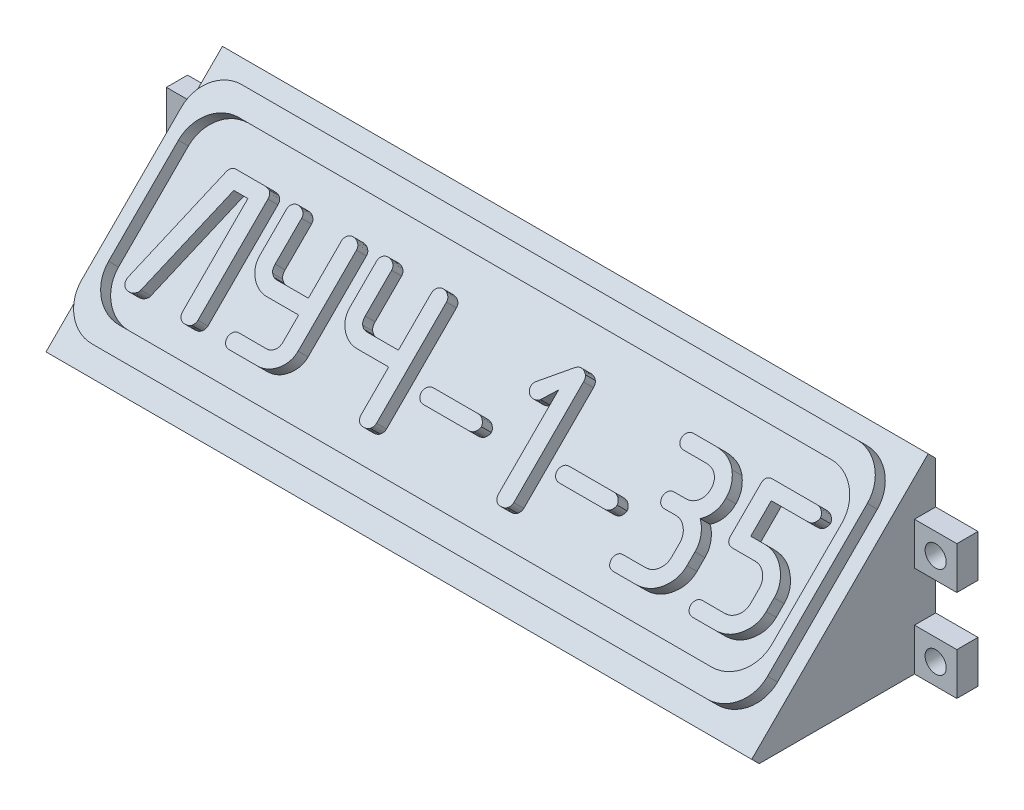
from build123d import *

# Parameters (mm, degrees)
EXTRUDE_1_DEPTH     = 50
CUT_EXTRUDE_1_DEPTH = 213.132034356
SKETCH_3_W          = 200
SKETCH_3_H          = 70.710678119
EXTRUDE_2_DEPTH     = 3
EXTRUDE_3_DEPTH     = 4
SKETCH_5_W          = 194.429654202
SKETCH_5_H          = 60
SKETCH_5_W_2        = 188
SKETCH_5_H_2        = 48
EXTRUDE_4_DEPTH     = 4
FILLET_1_R          = 10
SKETCH_6_W          = 12
SKETCH_6_H          = 12
SKETCH_6_R          = 3
EXTRUDE_5_DEPTH     = 6


with BuildPart() as part:
    # Эскиз1 → Бобышка-Вытянуть1 (new body)
    with BuildSketch(Plane(origin=(0, 0, 0), x_dir=(1, 0, 0), z_dir=(0, 1, 0))):
        Polygon((0, 0), (100, 0), (100, 50), (92, 50), (92, 8), (-92, 8), (-92, 50), (-100, 50), (-100, 0), align=None)
    extrude(amount=EXTRUDE_1_DEPTH)

    # Эскиз2 → Вырез-Вытянуть1 (cut, through all)
    with BuildSketch(Plane(origin=(100, 0, 0), x_dir=(0, 0, -1), z_dir=(1, 0, 0))):
        Polygon((0, 0), (0, 50), (50, 50), align=None)
    extrude(amount=-CUT_EXTRUDE_1_DEPTH, mode=Mode.SUBTRACT)

    # Эскиз3 → Бобышка-Вытянуть2 (add)
    with BuildSketch(Plane(origin=(0, 0, 0), x_dir=(1, 0, 0), z_dir=(0, 0.7071067811865474, 0.7071067811865477))):
        with Locations((0, 35.35533906)):
            Rectangle(SKETCH_3_W, SKETCH_3_H)
    extrude(amount=EXTRUDE_2_DEPTH)

    # Эскиз4 → Бобышка-Вытянуть3 (add)
    with BuildSketch(Plane(origin=(0, 2.121320344, 2.121320344), x_dir=(1, 0, 0), z_dir=(0, 0.7071067811865476, 0.7071067811865476))):
        with BuildLine():
            add(Edge.make_bspline(
                [(-68.75610477, 20.726091118), (-68.762630295, 20.596290065), (-68.775818947, 20.33395089), (-68.928925444, 19.954515658), (-69.143325973, 19.573958429), (-69.349908958, 19.350593076), (-69.458807473, 19.232847875)],
                knots=[0, 0, 0, 0, 0.915549064, 1.850403998, 2.866858221, 4, 4, 4, 4], degree=3))
            add(Edge.make_bspline(
                [(-69.458807473, 19.232847875), (-69.557018144, 19.155530235), (-69.764551665, 18.992146747), (-70.160156441, 18.844570702), (-70.623846008, 18.758511321), (-70.9560755, 18.746210297), (-71.134483148, 18.739604631)],
                knots=[0, 0, 0, 0, 0.836344935, 1.767319243, 2.801047675, 4, 4, 4, 4], degree=3))
            add(Edge.make_bspline(
                [(-71.134483148, 18.739604631), (-71.261288839, 18.746140205), (-71.509552353, 18.758935724), (-71.868243024, 18.859088148), (-72.205140544, 19.014263307), (-72.507750278, 19.239019575), (-72.773843335, 19.519875908), (-72.944245157, 19.880138063), (-73.068879563, 20.285380276), (-73.076447204, 20.578576094), (-73.080429094, 20.732847875)],
                knots=[0, 0, 0, 0, 0.970455498, 1.899983282, 2.834306599, 3.797520365, 4.775163954, 5.763265543, 6.823090279, 8, 8, 8, 8], degree=3))
            Line((-73.080429094, 20.732847875), (-73.080429094, 46.847712739))
            Line((-73.080429094, 46.847712739), (-77.066915581, 46.847712739))
            Line((-77.066915581, 46.847712739), (-84.593942608, 20.239604631))
            add(Edge.make_bspline(
                [(-84.593942608, 20.239604631), (-84.612488388, 20.15926614), (-84.652268426, 19.986942937), (-84.80705154, 19.73926588), (-85.035894883, 19.489588889), (-85.330239798, 19.242745342), (-85.67649211, 19.019065125), (-86.06474102, 18.856009391), (-86.485648626, 18.759151704), (-86.775858601, 18.74624074), (-86.925023689, 18.739604631)],
                knots=[0, 0, 0, 0, 0.663693597, 1.423599114, 2.327562058, 3.401457102, 4.524383031, 5.652035845, 6.793169396, 8, 8, 8, 8], degree=3))
            add(Edge.make_bspline(
                [(-86.925023689, 18.739604631), (-87.065252053, 18.746130508), (-87.33780213, 18.758814304), (-87.728727912, 18.856369384), (-88.084885015, 19.011587961), (-88.39890298, 19.229443915), (-88.663117122, 19.505113542), (-88.83655749, 19.852269931), (-88.959427453, 20.240313898), (-88.967915303, 20.520070521), (-88.972320986, 20.665280307)],
                knots=[0, 0, 0, 0, 1.061366862, 2.062889505, 3.033106798, 3.989267705, 4.943142053, 5.889662298, 6.904613293, 8, 8, 8, 8], degree=3))
            add(Edge.make_bspline(
                [(-88.972320986, 20.665280307), (-88.965344484, 20.787561054), (-88.953498157, 20.995197726), (-88.904588912, 21.197132997), (-88.884483148, 21.280145172)],
                knots=[0, 0, 0, 0, 1.177833825, 2, 2, 2, 2], degree=3))
            Line((-88.884483148, 21.280145172), (-81.00610477, 49.266631658))
            add(Edge.make_bspline(
                [(-81.00610477, 49.266631658), (-80.969711164, 49.383234768), (-80.899591004, 49.607895899), (-80.730604806, 49.906196308), (-80.543676296, 50.168240036), (-80.318642148, 50.382890542), (-80.053128645, 50.539547241), (-79.758770818, 50.653820253), (-79.431358864, 50.73300615), (-79.200296379, 50.737350784), (-79.080429094, 50.739604631)],
                knots=[0, 0, 0, 0, 1.110346038, 2.139322002, 3.108387218, 4.037936335, 4.949860985, 5.899151764, 6.910152063, 8, 8, 8, 8], degree=3))
            Line((-79.080429094, 50.739604631), (-71.195293959, 50.739604631))
            add(Edge.make_bspline(
                [(-71.195293959, 50.739604631), (-71.003584158, 50.732659583), (-70.644927717, 50.71966658), (-70.141368975, 50.637145543), (-69.715373637, 50.480750704), (-69.357056608, 50.265571161), (-69.088507592, 49.971060906), (-68.892021152, 49.620625821), (-68.777803821, 49.2059437), (-68.763586177, 48.909243507), (-68.75610477, 48.753118145)],
                knots=[0, 0, 0, 0, 1.280704927, 2.395981154, 3.390630075, 4.296225214, 5.1583056, 6.020254761, 6.958246576, 8, 8, 8, 8], degree=3))
            Line((-68.75610477, 48.753118145), (-68.75610477, 20.726091118))
        make_face()
        with BuildLine():
            Line((-47.999348013, 31.712577604), (-56.904753418, 31.712577604))
            add(Edge.make_bspline(
                [(-56.904753418, 31.712577604), (-57.128020967, 31.71716694), (-57.569588319, 31.726243496), (-58.219187145, 31.816599654), (-58.844423986, 31.964029352), (-59.442668127, 32.177041309), (-60.018618768, 32.442373645), (-60.578566135, 32.757507812), (-61.102978917, 33.150059101), (-61.609138846, 33.581373686), (-62.06122261, 34.065781942), (-62.467844713, 34.574772593), (-62.803203237, 35.116583835), (-63.08449806, 35.681160618), (-63.300737217, 36.272775804), (-63.458541915, 36.890282577), (-63.544548354, 37.536744349), (-63.559377691, 37.975858345), (-63.566915581, 38.199064091)],
                knots=[0, 0, 0, 0, 1.035673756, 2.048303581, 3.0370765, 4.012331002, 4.989879499, 5.977823305, 6.987643866, 8.025056878, 9.060255784, 10.057720171, 11.043837474, 12.011500143, 12.980460439, 13.961579086, 14.963851612, 16, 16, 16, 16], degree=3))
            Line((-63.566915581, 38.199064091), (-63.566915581, 48.793658685))
            add(Edge.make_bspline(
                [(-63.566915581, 48.793658685), (-63.561002076, 48.920607655), (-63.549164785, 49.174726288), (-63.433412508, 49.546102231), (-63.25076385, 49.901431055), (-63.079981225, 50.111725883), (-62.992591256, 50.219334361)],
                knots=[0, 0, 0, 0, 0.967126161, 1.935933617, 2.943811199, 4, 4, 4, 4], degree=3))
            add(Edge.make_bspline(
                [(-62.992591256, 50.219334361), (-62.891862375, 50.30033561), (-62.693468138, 50.459874569), (-62.35079697, 50.61956449), (-61.991483667, 50.719575543), (-61.745507988, 50.732872391), (-61.620969635, 50.739604631)],
                knots=[0, 0, 0, 0, 1.031857106, 2.03233173, 3.003762623, 4, 4, 4, 4], degree=3))
            add(Edge.make_bspline(
                [(-61.620969635, 50.739604631), (-61.460419505, 50.733979565), (-61.14668209, 50.722987397), (-60.698244195, 50.612400636), (-60.28980143, 50.432618431), (-59.927352751, 50.191720454), (-59.622094564, 49.899074021), (-59.401018911, 49.561888476), (-59.261830571, 49.189205665), (-59.249114413, 48.927770259), (-59.242591256, 48.793658685)],
                knots=[0, 0, 0, 0, 1.126357484, 2.201060098, 3.221373681, 4.248414814, 5.244384402, 6.170518649, 7.061509588, 8, 8, 8, 8], degree=3))
            Line((-59.242591256, 48.793658685), (-59.242591256, 38.199064091))
            add(Edge.make_bspline(
                [(-59.242591256, 38.199064091), (-59.235592841, 38.004562946), (-59.222430654, 37.638757223), (-59.105139733, 37.129619129), (-58.923321089, 36.688697345), (-58.728450364, 36.458644751), (-58.634483148, 36.347712739)],
                knots=[0, 0, 0, 0, 1.167822052, 2.196367477, 3.130283289, 4, 4, 4, 4], degree=3))
            add(Edge.make_bspline(
                [(-58.634483148, 36.347712739), (-58.551047979, 36.280282015), (-58.400319004, 36.158465713), (-58.196984879, 35.991221221), (-58.030548612, 35.871935056), (-57.931925852, 35.80695296), (-57.891239905, 35.780145172)],
                knots=[0, 0, 0, 0, 1.375792092, 2.485423497, 3.375174871, 4, 4, 4, 4], degree=3))
            add(Edge.make_bspline(
                [(-57.891239905, 35.780145172), (-57.728031409, 35.730823285), (-57.427674245, 35.640054835), (-57.115064439, 35.615624735), (-56.972320986, 35.604469496)],
                knots=[0, 0, 0, 0, 1.086762796, 2, 2, 2, 2], degree=3))
            Line((-56.972320986, 35.604469496), (-47.999348013, 35.604469496))
            Line((-47.999348013, 35.604469496), (-47.999348013, 48.793658685))
            add(Edge.make_bspline(
                [(-47.999348013, 48.793658685), (-47.993434508, 48.920607655), (-47.981597218, 49.174726288), (-47.865844941, 49.546102231), (-47.683196282, 49.901431055), (-47.512413657, 50.111725883), (-47.425023689, 50.219334361)],
                knots=[0, 0, 0, 0, 0.967126161, 1.935933617, 2.943811199, 4, 4, 4, 4], degree=3))
            add(Edge.make_bspline(
                [(-47.425023689, 50.219334361), (-47.324294807, 50.30033561), (-47.125900571, 50.459874569), (-46.783229403, 50.61956449), (-46.4239161, 50.719575543), (-46.17794042, 50.732872391), (-46.053402067, 50.739604631)],
                knots=[0, 0, 0, 0, 1.031857106, 2.03233173, 3.003762623, 4, 4, 4, 4], degree=3))
            add(Edge.make_bspline(
                [(-46.053402067, 50.739604631), (-45.892916617, 50.733822304), (-45.579305597, 50.722522829), (-45.129063842, 50.613904827), (-44.721949471, 50.425100147), (-44.359322919, 50.178096136), (-44.054104286, 49.878514209), (-43.833247076, 49.534563395), (-43.694285846, 49.155231227), (-43.681554673, 48.889457712), (-43.675023689, 48.753118145)],
                knots=[0, 0, 0, 0, 1.116529258, 2.181854371, 3.199692143, 4.226556143, 5.224865236, 6.156092035, 7.054090793, 8, 8, 8, 8], degree=3))
            Line((-43.675023689, 48.753118145), (-43.675023689, 25.401766794))
            add(Edge.make_bspline(
                [(-43.675023689, 25.401766794), (-43.681998948, 25.187474136), (-43.695870013, 24.761329795), (-43.792036388, 24.133912565), (-43.949706965, 23.52554643), (-44.166045546, 22.933268677), (-44.451767445, 22.359432622), (-44.798507557, 21.80341551), (-45.205889983, 21.265452522), (-45.676189086, 20.761137), (-46.184526135, 20.284724916), (-46.740750259, 19.8755177), (-47.321951552, 19.52005004), (-47.938819158, 19.233859978), (-48.588120149, 19.009294906), (-49.273099629, 18.857633842), (-49.987502627, 18.759237607), (-50.474239133, 18.746232916), (-50.722320986, 18.739604631)],
                knots=[0, 0, 0, 0, 0.954782777, 1.898689774, 2.821279558, 3.75164312, 4.70320268, 5.672383268, 6.66801769, 7.70503157, 8.74204545, 9.767778877, 10.776429994, 11.773227215, 12.792063222, 13.83169644, 14.894850172, 16, 16, 16, 16], degree=3))
            Line((-50.722320986, 18.739604631), (-58.452050716, 18.739604631))
            add(Edge.make_bspline(
                [(-58.452050716, 18.739604631), (-58.594860649, 18.744753265), (-58.871452802, 18.754725061), (-59.264181826, 18.870893838), (-59.623486641, 19.041570045), (-59.820295646, 19.214387247), (-59.918266932, 19.300415442)],
                knots=[0, 0, 0, 0, 1.061408071, 2.055719351, 3.032139439, 4, 4, 4, 4], degree=3))
            add(Edge.make_bspline(
                [(-59.918266932, 19.300415442), (-59.996409369, 19.399215832), (-60.150955975, 19.594618811), (-60.316169508, 19.933855499), (-60.411046738, 20.302025552), (-60.424811005, 20.556632252), (-60.431780446, 20.685550577)],
                knots=[0, 0, 0, 0, 0.999299836, 1.9763704, 2.97534928, 4, 4, 4, 4], degree=3))
            add(Edge.make_bspline(
                [(-60.431780446, 20.685550577), (-60.425527554, 20.801252062), (-60.413021772, 21.032655033), (-60.302397247, 21.369929641), (-60.138379576, 21.699202215), (-59.911282284, 22.012650541), (-59.627370029, 22.29113156), (-59.277314455, 22.493549739), (-58.875837067, 22.608782557), (-58.592442373, 22.623733481), (-58.445293959, 22.631496523)],
                knots=[0, 0, 0, 0, 0.896873142, 1.793746284, 2.732993467, 3.748250934, 4.788101686, 5.799732142, 6.857544153, 8, 8, 8, 8], degree=3))
            Line((-58.445293959, 22.631496523), (-50.675023689, 22.631496523))
            add(Edge.make_bspline(
                [(-50.675023689, 22.631496523), (-50.496132759, 22.63997201), (-50.143106807, 22.65669766), (-49.636103349, 22.807858382), (-49.179282437, 23.069907612), (-48.768978058, 23.412328594), (-48.419214208, 23.836476003), (-48.176845852, 24.342423202), (-48.020928061, 24.908319779), (-48.006738021, 25.308317498), (-47.999348013, 25.516631658)],
                knots=[0, 0, 0, 0, 0.974167649, 1.922436556, 2.851822555, 3.828465071, 4.824079232, 5.823852042, 6.866687452, 8, 8, 8, 8], degree=3))
            Line((-47.999348013, 25.516631658), (-47.999348013, 31.712577604))
        make_face()
        with BuildLine():
            Line((-22.4858345, 35.604469496), (-22.4858345, 48.793658685))
            add(Edge.make_bspline(
                [(-22.4858345, 48.793658685), (-22.479920995, 48.920607655), (-22.468083704, 49.174726288), (-22.352331427, 49.546102231), (-22.169682769, 49.901431055), (-21.998900144, 50.111725883), (-21.911510175, 50.219334361)],
                knots=[0, 0, 0, 0, 0.967126161, 1.935933617, 2.943811199, 4, 4, 4, 4], degree=3))
            add(Edge.make_bspline(
                [(-21.911510175, 50.219334361), (-21.810781293, 50.30033561), (-21.612387057, 50.459874569), (-21.269715889, 50.61956449), (-20.910402586, 50.719575543), (-20.664426907, 50.732872391), (-20.539888554, 50.739604631)],
                knots=[0, 0, 0, 0, 1.031857106, 2.03233173, 3.003762623, 4, 4, 4, 4], degree=3))
            add(Edge.make_bspline(
                [(-20.539888554, 50.739604631), (-20.379403104, 50.733822304), (-20.065792084, 50.722522829), (-19.615550329, 50.613904827), (-19.208435957, 50.425100147), (-18.845809405, 50.178096136), (-18.540590772, 49.878514209), (-18.319733562, 49.534563395), (-18.180772332, 49.155231227), (-18.168041159, 48.889457712), (-18.161510175, 48.753118145)],
                knots=[0, 0, 0, 0, 1.116529258, 2.181854371, 3.199692143, 4.226556143, 5.224865236, 6.156092035, 7.054090793, 8, 8, 8, 8], degree=3))
            Line((-18.161510175, 48.753118145), (-18.161510175, 20.726091118))
            add(Edge.make_bspline(
                [(-18.161510175, 20.726091118), (-18.1680357, 20.596290065), (-18.181224352, 20.33395089), (-18.334330849, 19.954515658), (-18.548731378, 19.573958429), (-18.755314364, 19.350593076), (-18.864212878, 19.232847875)],
                knots=[0, 0, 0, 0, 0.915549064, 1.850403998, 2.866858221, 4, 4, 4, 4], degree=3))
            add(Edge.make_bspline(
                [(-18.864212878, 19.232847875), (-18.962423549, 19.155530235), (-19.16995707, 18.992146747), (-19.565561847, 18.844570702), (-20.029251414, 18.758511321), (-20.361480906, 18.746210297), (-20.539888554, 18.739604631)],
                knots=[0, 0, 0, 0, 0.836344935, 1.767319243, 2.801047675, 4, 4, 4, 4], degree=3))
            add(Edge.make_bspline(
                [(-20.539888554, 18.739604631), (-20.666633271, 18.746281181), (-20.914777411, 18.759352706), (-21.275282802, 18.857757017), (-21.610858051, 19.021889518), (-21.913371213, 19.252831549), (-22.181581327, 19.541795985), (-22.349259769, 19.914633916), (-22.474311774, 20.332867829), (-22.481864346, 20.634893264), (-22.4858345, 20.793658685)],
                knots=[0, 0, 0, 0, 0.955036435, 1.869795435, 2.796619091, 3.754672073, 4.729445222, 5.732233119, 6.807905155, 8, 8, 8, 8], degree=3))
            Line((-22.4858345, 20.793658685), (-22.4858345, 31.712577604))
            Line((-22.4858345, 31.712577604), (-31.391239905, 31.712577604))
            add(Edge.make_bspline(
                [(-31.391239905, 31.712577604), (-31.614507453, 31.71716694), (-32.056074806, 31.726243496), (-32.705673632, 31.816599654), (-33.330910472, 31.964029352), (-33.929154613, 32.177041309), (-34.505105254, 32.442373645), (-35.065052622, 32.757507812), (-35.589465404, 33.150059101), (-36.095625333, 33.581373686), (-36.547709096, 34.065781942), (-36.954331199, 34.574772593), (-37.289689723, 35.116583835), (-37.570984547, 35.681160618), (-37.787223703, 36.272775804), (-37.945028402, 36.890282577), (-38.031034841, 37.536744349), (-38.045864177, 37.975858345), (-38.053402067, 38.199064091)],
                knots=[0, 0, 0, 0, 1.035673756, 2.048303581, 3.0370765, 4.012331002, 4.989879499, 5.977823305, 6.987643866, 8.025056878, 9.060255784, 10.057720171, 11.043837474, 12.011500143, 12.980460439, 13.961579086, 14.963851612, 16, 16, 16, 16], degree=3))
            Line((-38.053402067, 38.199064091), (-38.053402067, 48.793658685))
            add(Edge.make_bspline(
                [(-38.053402067, 48.793658685), (-38.047488562, 48.920607655), (-38.035651272, 49.174726288), (-37.919898995, 49.546102231), (-37.737250336, 49.901431055), (-37.566467711, 50.111725883), (-37.479077743, 50.219334361)],
                knots=[0, 0, 0, 0, 0.967126161, 1.935933617, 2.943811199, 4, 4, 4, 4], degree=3))
            add(Edge.make_bspline(
                [(-37.479077743, 50.219334361), (-37.378348861, 50.30033561), (-37.179954625, 50.459874569), (-36.837283457, 50.61956449), (-36.477970154, 50.719575543), (-36.231994474, 50.732872391), (-36.107456121, 50.739604631)],
                knots=[0, 0, 0, 0, 1.031857106, 2.03233173, 3.003762623, 4, 4, 4, 4], degree=3))
            add(Edge.make_bspline(
                [(-36.107456121, 50.739604631), (-35.946905991, 50.733979565), (-35.633168577, 50.722987397), (-35.184730682, 50.612400636), (-34.776287917, 50.432618431), (-34.413839237, 50.191720454), (-34.10858105, 49.899074021), (-33.887505397, 49.561888476), (-33.748317057, 49.189205665), (-33.735600899, 48.927770259), (-33.729077743, 48.793658685)],
                knots=[0, 0, 0, 0, 1.126357484, 2.201060098, 3.221373681, 4.248414814, 5.244384402, 6.170518649, 7.061509588, 8, 8, 8, 8], degree=3))
            Line((-33.729077743, 48.793658685), (-33.729077743, 38.199064091))
            add(Edge.make_bspline(
                [(-33.729077743, 38.199064091), (-33.722079327, 38.004562946), (-33.708917141, 37.638757223), (-33.591626219, 37.129619129), (-33.409807576, 36.688697345), (-33.21493685, 36.458644751), (-33.120969635, 36.347712739)],
                knots=[0, 0, 0, 0, 1.167822052, 2.196367477, 3.130283289, 4, 4, 4, 4], degree=3))
            add(Edge.make_bspline(
                [(-33.120969635, 36.347712739), (-33.037534465, 36.280282015), (-32.886805491, 36.158465713), (-32.683471366, 35.991221221), (-32.517035098, 35.871935056), (-32.418412338, 35.80695296), (-32.377726391, 35.780145172)],
                knots=[0, 0, 0, 0, 1.375792092, 2.485423497, 3.375174871, 4, 4, 4, 4], degree=3))
            add(Edge.make_bspline(
                [(-32.377726391, 35.780145172), (-32.214517896, 35.730823285), (-31.914160732, 35.640054835), (-31.601550925, 35.615624735), (-31.458807473, 35.604469496)],
                knots=[0, 0, 0, 0, 1.086762796, 2, 2, 2, 2], degree=3))
            Line((-31.458807473, 35.604469496), (-22.4858345, 35.604469496))
        make_face()
        with BuildLine():
            Line((2.102003338, 28.685550577), (-10.431780446, 28.685550577))
            add(Edge.make_bspline(
                [(-10.431780446, 28.685550577), (-10.574501978, 28.690990166), (-10.853098572, 28.7016084), (-11.249035589, 28.81514212), (-11.61077921, 28.989390869), (-11.811109213, 29.160570131), (-11.911510175, 29.246361388)],
                knots=[0, 0, 0, 0, 1.05367648, 2.056807225, 3.026114798, 4, 4, 4, 4], degree=3))
            add(Edge.make_bspline(
                [(-11.911510175, 29.246361388), (-11.992360506, 29.344827158), (-12.151425718, 29.538549042), (-12.315883104, 29.880015953), (-12.411121168, 30.247915752), (-12.424836024, 30.50255946), (-12.431780446, 30.631496523)],
                knots=[0, 0, 0, 0, 1.007300164, 1.981765708, 2.978081156, 4, 4, 4, 4], degree=3))
            add(Edge.make_bspline(
                [(-12.431780446, 30.631496523), (-12.42555638, 30.74722), (-12.41310825, 30.978666953), (-12.302044524, 31.315606494), (-12.13923087, 31.647448003), (-11.903625833, 31.956139637), (-11.62019655, 32.239745724), (-11.264872371, 32.437619008), (-10.862552117, 32.555097275), (-10.579006976, 32.569805464), (-10.431780446, 32.577442469)],
                knots=[0, 0, 0, 0, 0.894019722, 1.788039445, 2.724298395, 3.746649061, 4.783191508, 5.806732337, 6.861178898, 8, 8, 8, 8], degree=3))
            Line((-10.431780446, 32.577442469), (2.102003338, 32.577442469))
            add(Edge.make_bspline(
                [(2.102003338, 32.577442469), (2.280833184, 32.57112737), (2.623381656, 32.559030801), (3.105973194, 32.426518625), (3.529661499, 32.213602119), (3.883736135, 31.924481452), (4.155895593, 31.595516852), (4.377764265, 31.279109761), (4.507991589, 30.954080517), (4.525863682, 30.736064655), (4.534435771, 30.631496523)],
                knots=[0, 0, 0, 0, 1.252626121, 2.399404643, 3.481239833, 4.560298709, 5.580657481, 6.470831737, 7.266556721, 8, 8, 8, 8], degree=3))
            add(Edge.make_bspline(
                [(4.534435771, 30.631496523), (4.527095624, 30.536181645), (4.511523752, 30.333974378), (4.401327683, 30.02439217), (4.220805679, 29.702446528), (3.985057394, 29.366175499), (3.662837181, 29.05209282), (3.221851075, 28.837536457), (2.693604249, 28.700432141), (2.307968359, 28.690731573), (2.102003338, 28.685550577)],
                knots=[0, 0, 0, 0, 0.660560635, 1.401356889, 2.253898629, 3.2161103, 4.243656392, 5.333295804, 6.575734779, 8, 8, 8, 8], degree=3))
        make_face()
        with BuildLine():
            add(Edge.make_bspline(
                [(20.757408744, 20.726091118), (20.750514218, 20.596434266), (20.736466617, 20.332258325), (20.588125059, 19.950567235), (20.367612021, 19.573200883), (20.163170669, 19.350826644), (20.054706041, 19.232847875)],
                knots=[0, 0, 0, 0, 0.915262352, 1.864847777, 2.867213074, 4, 4, 4, 4], degree=3))
            add(Edge.make_bspline(
                [(20.054706041, 19.232847875), (19.95649537, 19.155530235), (19.748961849, 18.992146747), (19.353357072, 18.844570702), (18.889667505, 18.758511321), (18.557438013, 18.746210297), (18.379030365, 18.739604631)],
                knots=[0, 0, 0, 0, 0.836344935, 1.767319243, 2.801047675, 4, 4, 4, 4], degree=3))
            add(Edge.make_bspline(
                [(18.379030365, 18.739604631), (18.252224678, 18.746140207), (18.003961171, 18.758935728), (17.645270451, 18.859088132), (17.308373117, 19.014263368), (17.00576266, 19.239019338), (16.73967237, 19.519876812), (16.569259832, 19.880134547), (16.444004851, 20.28755852), (16.436866344, 20.583053635), (16.433084419, 20.739604631)],
                knots=[0, 0, 0, 0, 0.968371671, 1.895903512, 2.828220588, 3.789366078, 4.764910405, 5.750890277, 6.808439288, 8, 8, 8, 8], degree=3))
            Line((16.433084419, 20.739604631), (16.433084419, 44.746361388))
            Line((16.433084419, 44.746361388), (13.791192527, 41.266631658))
            add(Edge.make_bspline(
                [(13.791192527, 41.266631658), (13.684250543, 41.176085004), (13.466232761, 40.991491639), (13.063568087, 40.801873676), (12.600708674, 40.695818655), (12.273760058, 40.680227568), (12.102003338, 40.672037064)],
                knots=[0, 0, 0, 0, 0.913450038, 1.862209237, 2.87694913, 4, 4, 4, 4], degree=3))
            add(Edge.make_bspline(
                [(12.102003338, 40.672037064), (11.981761095, 40.678135318), (11.736472108, 40.690575494), (11.379490705, 40.807689836), (11.02310554, 40.977666078), (10.808805871, 41.140717114), (10.696597933, 41.226091118)],
                knots=[0, 0, 0, 0, 0.934684398, 1.906715833, 2.903950235, 4, 4, 4, 4], degree=3))
            add(Edge.make_bspline(
                [(10.696597933, 41.226091118), (10.596570728, 41.327808008), (10.403440393, 41.524200749), (10.209153757, 41.880388276), (10.076155666, 42.25273917), (10.061913123, 42.513206874), (10.054706041, 42.645010037)],
                knots=[0, 0, 0, 0, 1.064137443, 2.054613257, 3.01558573, 4, 4, 4, 4], degree=3))
            add(Edge.make_bspline(
                [(10.054706041, 42.645010037), (10.061161002, 42.758391355), (10.074076034, 42.985243762), (10.182449434, 43.319127099), (10.360438716, 43.637543832), (10.51989922, 43.829802407), (10.602003338, 43.928793821)],
                knots=[0, 0, 0, 0, 0.951424687, 1.903602679, 2.920592565, 4, 4, 4, 4], degree=3))
            Line((10.602003338, 43.928793821), (16.926327663, 50.050415442))
            add(Edge.make_bspline(
                [(16.926327663, 50.050415442), (17.047780049, 50.159277769), (17.28563738, 50.372478211), (17.681964932, 50.638873938), (18.130073296, 50.821338482), (18.451589486, 50.838806529), (18.615516852, 50.847712739)],
                knots=[0, 0, 0, 0, 1.019784961, 1.997188649, 2.97885208, 4, 4, 4, 4], degree=3))
            add(Edge.make_bspline(
                [(18.615516852, 50.847712739), (18.753988609, 50.837958712), (19.040087417, 50.817805753), (19.466137, 50.665764343), (19.890100854, 50.415478392), (20.152472731, 50.194354082), (20.291192527, 50.077442469)],
                knots=[0, 0, 0, 0, 0.880341502, 1.81888826, 2.846814756, 4, 4, 4, 4], degree=3))
            add(Edge.make_bspline(
                [(20.291192527, 50.077442469), (20.362606598, 49.976067216), (20.506247025, 49.772163636), (20.652808773, 49.423053717), (20.745085162, 49.043961419), (20.753216819, 48.780715239), (20.757408744, 48.645010037)],
                knots=[0, 0, 0, 0, 0.967253322, 1.945508478, 2.9408956, 4, 4, 4, 4], degree=3))
            Line((20.757408744, 48.645010037), (20.757408744, 20.726091118))
        make_face()
        with BuildLine():
            Line((40.588489825, 28.685550577), (28.054706041, 28.685550577))
            add(Edge.make_bspline(
                [(28.054706041, 28.685550577), (27.911984509, 28.690990166), (27.633387914, 28.7016084), (27.237450898, 28.81514212), (26.875707276, 28.989390869), (26.675377274, 29.160570131), (26.574976311, 29.246361388)],
                knots=[0, 0, 0, 0, 1.05367648, 2.056807225, 3.026114798, 4, 4, 4, 4], degree=3))
            add(Edge.make_bspline(
                [(26.574976311, 29.246361388), (26.49412598, 29.344827158), (26.335060769, 29.538549042), (26.170603383, 29.880015953), (26.075365319, 30.247915752), (26.061650463, 30.50255946), (26.054706041, 30.631496523)],
                knots=[0, 0, 0, 0, 1.007300164, 1.981765708, 2.978081156, 4, 4, 4, 4], degree=3))
            add(Edge.make_bspline(
                [(26.054706041, 30.631496523), (26.060930106, 30.74722), (26.073378237, 30.978666953), (26.184441962, 31.315606494), (26.347255616, 31.647448003), (26.582860653, 31.956139637), (26.866289936, 32.239745724), (27.221614115, 32.437619008), (27.62393437, 32.555097275), (27.90747951, 32.569805464), (28.054706041, 32.577442469)],
                knots=[0, 0, 0, 0, 0.894019722, 1.788039445, 2.724298395, 3.746649061, 4.783191508, 5.806732337, 6.861178898, 8, 8, 8, 8], degree=3))
            Line((28.054706041, 32.577442469), (40.588489825, 32.577442469))
            add(Edge.make_bspline(
                [(40.588489825, 32.577442469), (40.767319671, 32.57112737), (41.109868142, 32.559030801), (41.59245968, 32.426518625), (42.016147986, 32.213602119), (42.370222621, 31.924481452), (42.64238208, 31.595516852), (42.864250752, 31.279109761), (42.994478076, 30.954080517), (43.012350168, 30.736064655), (43.020922257, 30.631496523)],
                knots=[0, 0, 0, 0, 1.252626121, 2.399404643, 3.481239833, 4.560298709, 5.580657481, 6.470831737, 7.266556721, 8, 8, 8, 8], degree=3))
            add(Edge.make_bspline(
                [(43.020922257, 30.631496523), (43.01358211, 30.536181645), (42.998010239, 30.333974378), (42.887814169, 30.02439217), (42.707292165, 29.702446528), (42.47154388, 29.366175499), (42.149323667, 29.05209282), (41.708337561, 28.837536457), (41.180090735, 28.700432141), (40.794454846, 28.690731573), (40.588489825, 28.685550577)],
                knots=[0, 0, 0, 0, 0.660560635, 1.401356889, 2.253898629, 3.2161103, 4.243656392, 5.333295804, 6.575734779, 8, 8, 8, 8], degree=3))
        make_face()
        with BuildLine():
            Line((56.791192527, 46.847712739), (50.45335469, 46.847712739))
            add(Edge.make_bspline(
                [(50.45335469, 46.847712739), (50.308443794, 46.853256782), (50.025538555, 46.864080252), (49.624229864, 46.975620924), (49.259992045, 47.153412749), (49.056183896, 47.3229735), (48.95335469, 47.40852355)],
                knots=[0, 0, 0, 0, 1.058158881, 2.065812162, 3.024126364, 4, 4, 4, 4], degree=3))
            add(Edge.make_bspline(
                [(48.95335469, 47.40852355), (48.872504359, 47.50698932), (48.713439147, 47.700711204), (48.548981761, 48.042178115), (48.453743697, 48.410077915), (48.440028841, 48.664721622), (48.433084419, 48.793658685)],
                knots=[0, 0, 0, 0, 1.007300164, 1.981765708, 2.978081156, 4, 4, 4, 4], degree=3))
            add(Edge.make_bspline(
                [(48.433084419, 48.793658685), (48.439337311, 48.90936017), (48.451843093, 49.140763141), (48.562467618, 49.478037749), (48.726485289, 49.807310323), (48.953582581, 50.120758649), (49.237494836, 50.399239668), (49.58755041, 50.601657847), (49.989027798, 50.716890665), (50.272422492, 50.73184159), (50.419570906, 50.739604631)],
                knots=[0, 0, 0, 0, 0.896873142, 1.793746284, 2.732993467, 3.748250934, 4.788101686, 5.799732142, 6.857544153, 8, 8, 8, 8], degree=3))
            Line((50.419570906, 50.739604631), (56.649300636, 50.739604631))
            add(Edge.make_bspline(
                [(56.649300636, 50.739604631), (56.985242847, 50.731838997), (57.638896572, 50.716729149), (58.590604989, 50.598949803), (59.487535527, 50.412753027), (60.329538225, 50.144317238), (61.109466319, 49.787233589), (61.839370304, 49.370222695), (62.510114895, 48.866748468), (62.903814407, 48.472070103), (63.102003338, 48.273388415)],
                knots=[0, 0, 0, 0, 1.13341989, 2.205332069, 3.230945865, 4.221254155, 5.180537684, 6.120475399, 7.053844463, 8, 8, 8, 8], degree=3))
            add(Edge.make_bspline(
                [(63.102003338, 48.273388415), (63.277210245, 48.071621353), (63.623359311, 47.672998484), (64.065170594, 47.028589708), (64.447914509, 46.370532193), (64.763642149, 45.691503098), (64.997022104, 44.987477215), (65.168411938, 44.264270598), (65.271729915, 43.521882799), (65.284683828, 43.019203232), (65.291192527, 42.766631658)],
                knots=[0, 0, 0, 0, 1.056133692, 2.086559815, 3.084278045, 4.064788451, 5.042259387, 6.012396743, 7.001327852, 8, 8, 8, 8], degree=3))
            add(Edge.make_bspline(
                [(65.291192527, 42.766631658), (65.286441985, 42.462201693), (65.277036614, 41.859475472), (65.14934623, 40.970794918), (64.908911831, 40.118581153), (64.570960854, 39.3063018), (64.137425937, 38.543363776), (63.618463535, 37.831915164), (63.009783269, 37.177973912), (62.541626988, 36.801665522), (62.304706041, 36.611226253)],
                knots=[0, 0, 0, 0, 1.026966331, 2.033241159, 3.020031122, 4.008284081, 4.99551317, 5.974719338, 6.975061468, 8, 8, 8, 8], degree=3))
            add(Edge.make_bspline(
                [(62.304706041, 36.611226253), (62.507964381, 36.447735799), (62.924076179, 36.113037076), (63.470794565, 35.48805134), (63.982716411, 34.773399377), (64.44385546, 33.968403962), (64.834051225, 33.104687146), (65.114994537, 32.19789725), (65.275221272, 31.263464035), (65.285840836, 30.632101738), (65.291192527, 30.313928956)],
                knots=[0, 0, 0, 0, 0.866803985, 1.774526765, 2.752324719, 3.790045522, 4.857216549, 5.90058151, 6.942005526, 8, 8, 8, 8], degree=3))
            Line((65.291192527, 30.313928956), (65.297949284, 27.131496523))
            add(Edge.make_bspline(
                [(65.297949284, 27.131496523), (65.289618414, 26.86086047), (65.273089893, 26.323916098), (65.157319432, 25.530625783), (64.958198466, 24.762128631), (64.688113436, 24.017031056), (64.340407436, 23.294453733), (63.911584292, 22.595761085), (63.402821746, 21.921351851), (62.827344973, 21.276034673), (62.19000792, 20.687569797), (61.513989223, 20.163819946), (60.798212963, 19.717909611), (60.039615578, 19.361671379), (59.245057539, 19.081967306), (58.413351579, 18.888428292), (57.545104043, 18.761257118), (56.951563477, 18.746910634), (56.649300636, 18.739604631)],
                knots=[0, 0, 0, 0, 0.970801741, 1.926079414, 2.868698377, 3.814428873, 4.764876258, 5.74044097, 6.750431083, 7.791832276, 8.838143038, 9.857911005, 10.855707632, 11.856868197, 12.858582888, 13.871799816, 14.916205779, 16, 16, 16, 16], degree=3))
            Line((56.649300636, 18.739604631), (50.419570906, 18.739604631))
            add(Edge.make_bspline(
                [(50.419570906, 18.739604631), (50.276865747, 18.745066166), (49.998301115, 18.755727242), (49.602135743, 18.86895488), (49.236745473, 19.046495071), (49.031223864, 19.219084339), (48.926327663, 19.307172199)],
                knots=[0, 0, 0, 0, 1.04413253, 2.038177155, 2.998704971, 4, 4, 4, 4], degree=3))
            add(Edge.make_bspline(
                [(48.926327663, 19.307172199), (48.850502941, 19.4106941), (48.701284718, 19.614418609), (48.545072454, 19.955837342), (48.454984281, 20.316090433), (48.440456745, 20.561176253), (48.433084419, 20.685550577)],
                knots=[0, 0, 0, 0, 1.030422284, 2.027805432, 2.999165404, 4, 4, 4, 4], degree=3))
            add(Edge.make_bspline(
                [(48.433084419, 20.685550577), (48.440113225, 20.798805902), (48.454270346, 21.02691993), (48.554473086, 21.363062309), (48.713619823, 21.689929148), (48.925262561, 22.007828678), (49.207571834, 22.286890078), (49.560826802, 22.496167226), (49.980449539, 22.609302989), (50.277024798, 22.623844628), (50.433084419, 22.631496523)],
                knots=[0, 0, 0, 0, 0.872420718, 1.757192482, 2.681291623, 3.668475677, 4.687512535, 5.714798453, 6.797513696, 8, 8, 8, 8], degree=3))
            Line((50.433084419, 22.631496523), (56.70335469, 22.631496523))
            add(Edge.make_bspline(
                [(56.70335469, 22.631496523), (56.986617879, 22.646685162), (57.546012878, 22.676680053), (58.349952354, 22.927943789), (59.083695199, 23.348657255), (59.736771978, 23.910862889), (60.283156859, 24.590798121), (60.689148041, 25.352323249), (60.927294499, 26.189625119), (60.957909702, 26.767365746), (60.97362496, 27.063928956)],
                knots=[0, 0, 0, 0, 0.993475619, 1.961939683, 2.925576866, 3.94673414, 4.971012636, 5.972520021, 6.959263134, 8, 8, 8, 8], degree=3))
            Line((60.97362496, 27.063928956), (60.97362496, 30.307172199))
            add(Edge.make_bspline(
                [(60.97362496, 30.307172199), (60.961537607, 30.601843928), (60.937869183, 31.178844956), (60.685418503, 32.005508637), (60.298111553, 32.770388428), (59.754552643, 33.443408371), (59.115973265, 34.021076141), (58.377759767, 34.44350794), (57.561811848, 34.695642168), (56.993411695, 34.724750517), (56.70335469, 34.739604631)],
                knots=[0, 0, 0, 0, 1.030923828, 2.018667042, 3.004670295, 4.022795447, 5.036002388, 6.009257811, 6.984115828, 8, 8, 8, 8], degree=3))
            Line((56.70335469, 34.739604631), (53.561462798, 34.739604631))
            add(Edge.make_bspline(
                [(53.561462798, 34.739604631), (53.418708936, 34.744967073), (53.140049234, 34.755434717), (52.742610486, 34.870610209), (52.373038877, 35.044368759), (52.166226943, 35.218807335), (52.061462798, 35.307172199)],
                knots=[0, 0, 0, 0, 1.040282098, 2.030660999, 3.002397432, 4, 4, 4, 4], degree=3))
            add(Edge.make_bspline(
                [(52.061462798, 35.307172199), (51.985749131, 35.410775557), (51.837957049, 35.613007951), (51.679355393, 35.953588403), (51.582306686, 36.313075381), (51.568427951, 36.561084978), (51.561462798, 36.685550577)],
                knots=[0, 0, 0, 0, 1.028974178, 2.008544084, 3.000571928, 4, 4, 4, 4], degree=3))
            add(Edge.make_bspline(
                [(51.561462798, 36.685550577), (51.56846735, 36.798820797), (51.58257562, 37.026964828), (51.683154229, 37.362876359), (51.841329056, 37.691839647), (52.06112013, 38.008168742), (52.348864105, 38.284954789), (52.704276875, 38.497983146), (53.129407743, 38.608887216), (53.430258316, 38.623703789), (53.588489825, 38.631496523)],
                knots=[0, 0, 0, 0, 0.866315224, 1.744895057, 2.662527041, 3.652607709, 4.676920528, 5.697017153, 6.788752676, 8, 8, 8, 8], degree=3))
            Line((53.588489825, 38.631496523), (56.770922257, 38.631496523))
            add(Edge.make_bspline(
                [(56.770922257, 38.631496523), (57.078906796, 38.646232706), (57.678164056, 38.674905459), (58.531168925, 38.922293629), (59.292311928, 39.344256128), (59.708616947, 39.736691877), (59.919570906, 39.935550577)],
                knots=[0, 0, 0, 0, 1.052500521, 2.047890389, 3.010808826, 4, 4, 4, 4], degree=3))
            add(Edge.make_bspline(
                [(59.919570906, 39.935550577), (60.081588815, 40.136991546), (60.405141127, 40.539272326), (60.7327711, 41.249190954), (60.93676191, 42.020987451), (60.961108383, 42.558079151), (60.97362496, 42.834199226)],
                knots=[0, 0, 0, 0, 0.980805097, 1.958683196, 2.950554346, 4, 4, 4, 4], degree=3))
            add(Edge.make_bspline(
                [(60.97362496, 42.834199226), (60.963528348, 43.101343869), (60.943912898, 43.620345904), (60.746150878, 44.358784545), (60.439337601, 45.035129684), (60.12907698, 45.40992597), (59.97362496, 45.597712739)],
                knots=[0, 0, 0, 0, 1.063590795, 2.066318012, 3.03115397, 4, 4, 4, 4], degree=3))
            add(Edge.make_bspline(
                [(59.97362496, 45.597712739), (59.772406112, 45.791080958), (59.368295241, 46.179425291), (58.599004168, 46.570346942), (57.728386197, 46.803709003), (57.112611902, 46.832621244), (56.791192527, 46.847712739)],
                knots=[0, 0, 0, 0, 0.947415208, 1.902708361, 2.905264196, 4, 4, 4, 4], degree=3))
        make_face()
        with BuildLine():
            Line((75.24389523, 46.847712739), (75.24389523, 38.631496523))
            Line((75.24389523, 38.631496523), (79.081733068, 38.631496523))
            add(Edge.make_bspline(
                [(79.081733068, 38.631496523), (79.383879729, 38.623377015), (79.976887027, 38.607441286), (80.846481572, 38.491890536), (81.679172688, 38.293976515), (82.474362623, 38.018859483), (83.234165196, 37.661562147), (83.958578207, 37.230197256), (84.64204772, 36.712784249), (85.279787354, 36.126818316), (85.862244087, 35.490820157), (86.377074425, 34.822711598), (86.815079262, 34.129797437), (87.166856944, 33.408089705), (87.447491436, 32.662487424), (87.643147473, 31.887469088), (87.759743274, 31.08775507), (87.776160988, 30.546293456), (87.784435771, 30.273388415)],
                knots=[0, 0, 0, 0, 1.081972753, 2.123530799, 3.135044873, 4.142692043, 5.131436003, 6.137144145, 7.156730983, 8.195818544, 9.234906105, 10.24164886, 11.212964997, 12.165340004, 13.112268028, 14.061118053, 15.022773467, 16, 16, 16, 16], degree=3))
            Line((87.784435771, 30.273388415), (87.784435771, 27.097712739))
            add(Edge.make_bspline(
                [(87.784435771, 27.097712739), (87.77617407, 26.827077645), (87.759850821, 26.292364049), (87.644093514, 25.503407873), (87.443019057, 24.740148929), (87.176124808, 23.994973224), (86.820214207, 23.277301113), (86.391751658, 22.581776442), (85.880380682, 21.913935609), (85.307032565, 21.269486963), (84.67189629, 20.680221377), (83.991547947, 20.164333575), (83.279555888, 19.719456141), (82.524555185, 19.360200612), (81.729471554, 19.081017292), (80.895136475, 18.889304762), (80.027097181, 18.761444531), (79.435801822, 18.746955935), (79.135787122, 18.739604631)],
                knots=[0, 0, 0, 0, 0.973115338, 1.922655314, 2.85967792, 3.807662264, 4.763914069, 5.734903704, 6.740833204, 7.784716246, 8.833520556, 9.850797801, 10.850972359, 11.847204032, 12.851305993, 13.874818936, 14.921713909, 16, 16, 16, 16], degree=3))
            Line((79.135787122, 18.739604631), (72.906057392, 18.739604631))
            add(Edge.make_bspline(
                [(72.906057392, 18.739604631), (72.763266818, 18.744778104), (72.486712159, 18.754798007), (72.09371711, 18.870625453), (71.733782902, 19.04332534), (71.533474538, 19.214584262), (71.433084419, 19.300415442)],
                knots=[0, 0, 0, 0, 1.057924657, 2.048972727, 3.022188321, 4, 4, 4, 4], degree=3))
            add(Edge.make_bspline(
                [(71.433084419, 19.300415442), (71.354941983, 19.399215832), (71.200395376, 19.594618811), (71.035181844, 19.933855499), (70.940304614, 20.302025552), (70.926540346, 20.556632252), (70.919570906, 20.685550577)],
                knots=[0, 0, 0, 0, 0.999299836, 1.9763704, 2.97534928, 4, 4, 4, 4], degree=3))
            add(Edge.make_bspline(
                [(70.919570906, 20.685550577), (70.925794971, 20.801274054), (70.938243102, 21.032721007), (71.049306827, 21.369660548), (71.212120481, 21.701502057), (71.447725518, 22.010193691), (71.731154801, 22.293799778), (72.08647898, 22.491673062), (72.488799235, 22.609151329), (72.772344375, 22.623859518), (72.919570906, 22.631496523)],
                knots=[0, 0, 0, 0, 0.894019722, 1.788039445, 2.724298395, 3.746649061, 4.783191508, 5.806732337, 6.861178898, 8, 8, 8, 8], degree=3))
            Line((72.919570906, 22.631496523), (79.189841176, 22.631496523))
            add(Edge.make_bspline(
                [(79.189841176, 22.631496523), (79.473246638, 22.646475241), (80.02794602, 22.675792551), (80.825124792, 22.926661609), (81.562677104, 23.324033654), (82.214188442, 23.879677171), (82.775650746, 24.540657612), (83.168904393, 25.31433225), (83.416600653, 26.163733644), (83.445329753, 26.758110321), (83.460111446, 27.063928956)],
                knots=[0, 0, 0, 0, 0.991348919, 1.940331813, 2.901160524, 3.909927732, 4.924762166, 5.920470752, 6.930040799, 8, 8, 8, 8], degree=3))
            Line((83.460111446, 27.063928956), (83.460111446, 30.307172199))
            add(Edge.make_bspline(
                [(83.460111446, 30.307172199), (83.448202858, 30.604105472), (83.424970963, 31.183378399), (83.172063244, 32.012445513), (82.784000849, 32.776469729), (82.243211697, 33.452936729), (81.593722419, 34.018596962), (80.859794387, 34.442557284), (80.046228172, 34.69641118), (79.479927663, 34.724973587), (79.189841176, 34.739604631)],
                knots=[0, 0, 0, 0, 1.038660488, 2.026273092, 3.012145964, 4.030136488, 5.043948606, 6.017075334, 6.98425016, 8, 8, 8, 8], degree=3))
            Line((79.189841176, 34.739604631), (72.919570906, 34.739604631))
            add(Edge.make_bspline(
                [(72.919570906, 34.739604631), (72.763863699, 34.746698499), (72.469979596, 34.76008757), (72.054782856, 34.842833055), (71.705298368, 35.002377593), (71.407117181, 35.212470009), (71.189894202, 35.501135261), (71.030151733, 35.843447615), (70.938285778, 36.246209799), (70.926018665, 36.534186286), (70.919570906, 36.685550577)],
                knots=[0, 0, 0, 0, 1.170859493, 2.209897665, 3.156768201, 4.040258301, 4.920500265, 5.836620012, 6.862898555, 8, 8, 8, 8], degree=3))
            Line((70.919570906, 36.685550577), (70.919570906, 48.793658685))
            add(Edge.make_bspline(
                [(70.919570906, 48.793658685), (70.926260782, 48.947297043), (70.938782558, 49.234869665), (71.025470965, 49.639157091), (71.177879183, 49.98633082), (71.412102888, 50.261237671), (71.692830056, 50.487359409), (72.046565715, 50.632605985), (72.454730868, 50.730582235), (72.749966085, 50.736484235), (72.906057392, 50.739604631)],
                knots=[0, 0, 0, 0, 1.155953375, 2.163655937, 3.096717245, 3.975853004, 4.857600385, 5.783704798, 6.828241359, 8, 8, 8, 8], degree=3))
            Line((72.906057392, 50.739604631), (85.365516852, 50.739604631))
            add(Edge.make_bspline(
                [(85.365516852, 50.739604631), (85.542103822, 50.73314811), (85.882416582, 50.72070531), (86.362421294, 50.588300509), (86.785926831, 50.377878067), (87.133979387, 50.084223372), (87.406092835, 49.75792252), (87.62772046, 49.441217843), (87.758001074, 49.116254388), (87.775866756, 48.898230613), (87.784435771, 48.793658685)],
                knots=[0, 0, 0, 0, 1.241205183, 2.392010925, 3.477645269, 4.548219275, 5.572161311, 6.465461653, 7.263981039, 8, 8, 8, 8], degree=3))
            add(Edge.make_bspline(
                [(87.784435771, 48.793658685), (87.777095624, 48.698343808), (87.761523752, 48.496136541), (87.651327683, 48.186554332), (87.470805679, 47.864608691), (87.235057394, 47.528337661), (86.912837181, 47.214254983), (86.471851075, 46.99969862), (85.943604249, 46.862594303), (85.557968359, 46.852893735), (85.352003338, 46.847712739)],
                knots=[0, 0, 0, 0, 0.660560635, 1.401356889, 2.253898629, 3.2161103, 4.243656392, 5.333295804, 6.575734779, 8, 8, 8, 8], degree=3))
            Line((85.352003338, 46.847712739), (75.24389523, 46.847712739))
        make_face()
    extrude(amount=EXTRUDE_3_DEPTH)

    # Эскиз5 → Бобышка-Вытянуть4 (add)
    with BuildSketch(Plane(origin=(0, 2.121320344, 2.121320344), x_dir=(1, 0, 0), z_dir=(0, 0.7071067811865476, 0.7071067811865476))):
        with Locations((-1.214827101, 36)):
            Rectangle(SKETCH_5_W, SKETCH_5_H)
        with Locations((-1, 36)):
            Rectangle(SKETCH_5_W_2, SKETCH_5_H_2, mode=Mode.SUBTRACT)
    extrude(amount=EXTRUDE_4_DEPTH)

    # Скругление1
    fillet_1_edges = [part.edges().sort_by_distance(p)[0] for p in [
        (96, 50.204581464, -43.133513652),
        (-98.429654202, 50.204581464, -43.133513652),
        (-98.429654202, 7.778174593, -0.707106781),
        (96, 7.778174593, -0.707106781),
        (-95, 12.02081528, -4.949747468),
        (93, 12.02081528, -4.949747468),
        (93, 45.961940777, -38.890872965),
        (-95, 45.961940777, -38.890872965),
    ]]
    fillet(fillet_1_edges, radius=FILLET_1_R)

    # Эскиз6 → Бобышка-Вытянуть5 (add)
    # profile 1 of 4: a face of its own
    with BuildSketch(Plane(origin=(0, 0, -50), x_dir=(-1, 0, 0), z_dir=(0, 0, -1))):
        with Locations((-106, 6)):
            Rectangle(SKETCH_6_W, SKETCH_6_H)
        with Locations((-106, 6)):
            Circle(SKETCH_6_R, mode=Mode.SUBTRACT)
    # profile 2 of 4: a face of its own
    with BuildSketch(Plane(origin=(0, 0, -50), x_dir=(-1, 0, 0), z_dir=(0, 0, -1))):
        with Locations((106, 6)):
            Rectangle(SKETCH_6_W, SKETCH_6_H)
        with Locations((106, 6)):
            Circle(SKETCH_6_R, mode=Mode.SUBTRACT)
    # profile 3 of 4: a face of its own
    with BuildSketch(Plane(origin=(0, 0, -50), x_dir=(-1, 0, 0), z_dir=(0, 0, -1))):
        with Locations((-106, 32)):
            Rectangle(SKETCH_6_W, SKETCH_6_H)
        with Locations((-106, 32)):
            Circle(SKETCH_6_R, mode=Mode.SUBTRACT)
    # profile 4 of 4: a face of its own
    with BuildSketch(Plane(origin=(0, 0, -50), x_dir=(-1, 0, 0), z_dir=(0, 0, -1))):
        with Locations((106, 32)):
            Rectangle(SKETCH_6_W, SKETCH_6_H)
        with Locations((106, 32)):
            Circle(SKETCH_6_R, mode=Mode.SUBTRACT)
    extrude(amount=-EXTRUDE_5_DEPTH)


solid = part.part
